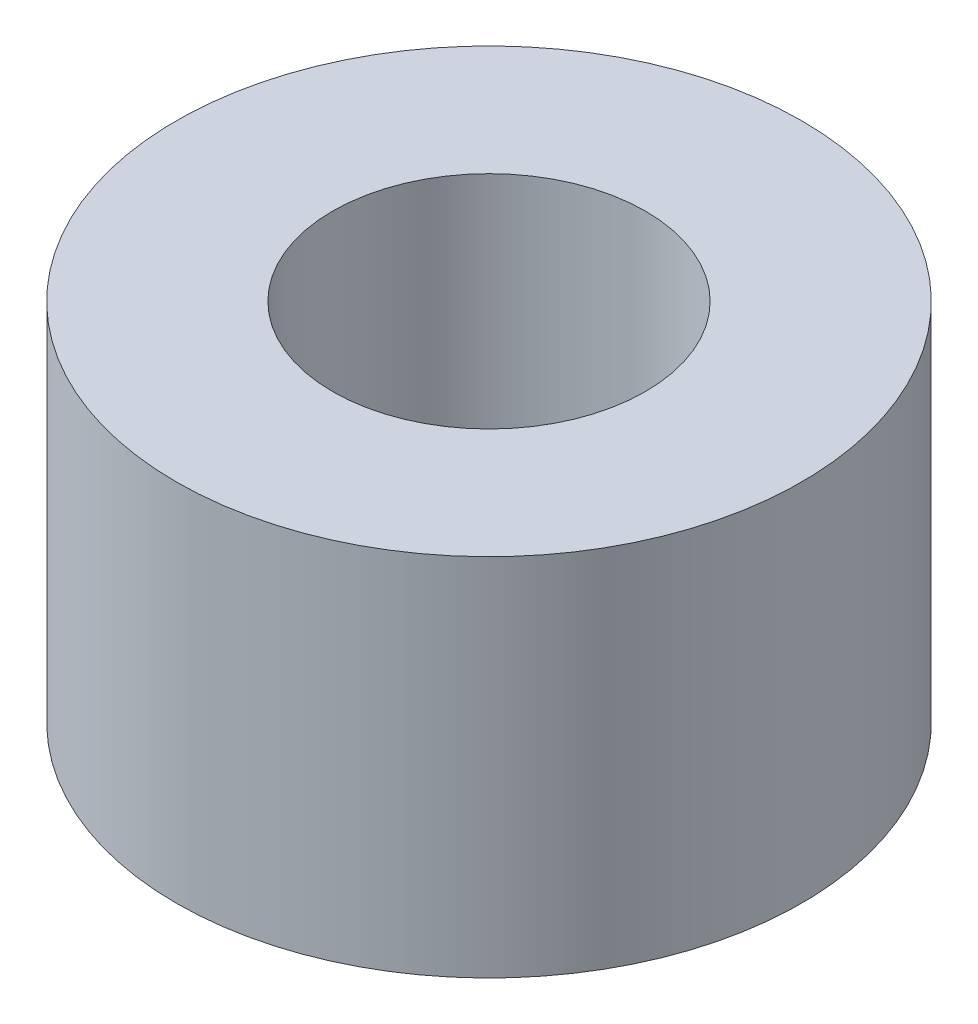
from build123d import *

# Parameters (mm, degrees)
SKETCH_1_R      = 6
SKETCH_1_R_2    = 3
EXTRUDE_1_DEPTH = 7


with BuildPart() as part:
    # 草图1 → 凸台-拉伸1 (new body)
    with BuildSketch(Plane(origin=(0, 0, 0), x_dir=(1, 0, 0), z_dir=(0, 1, 0))):
        with Locations(Location((0, 0, 0), (0, 0, 270))):
            Circle(SKETCH_1_R)
        with Locations(Location((0, 0, 0), (0, 0, 270))):
            Circle(SKETCH_1_R_2, mode=Mode.SUBTRACT)
    extrude(amount=EXTRUDE_1_DEPTH)


solid = part.part
